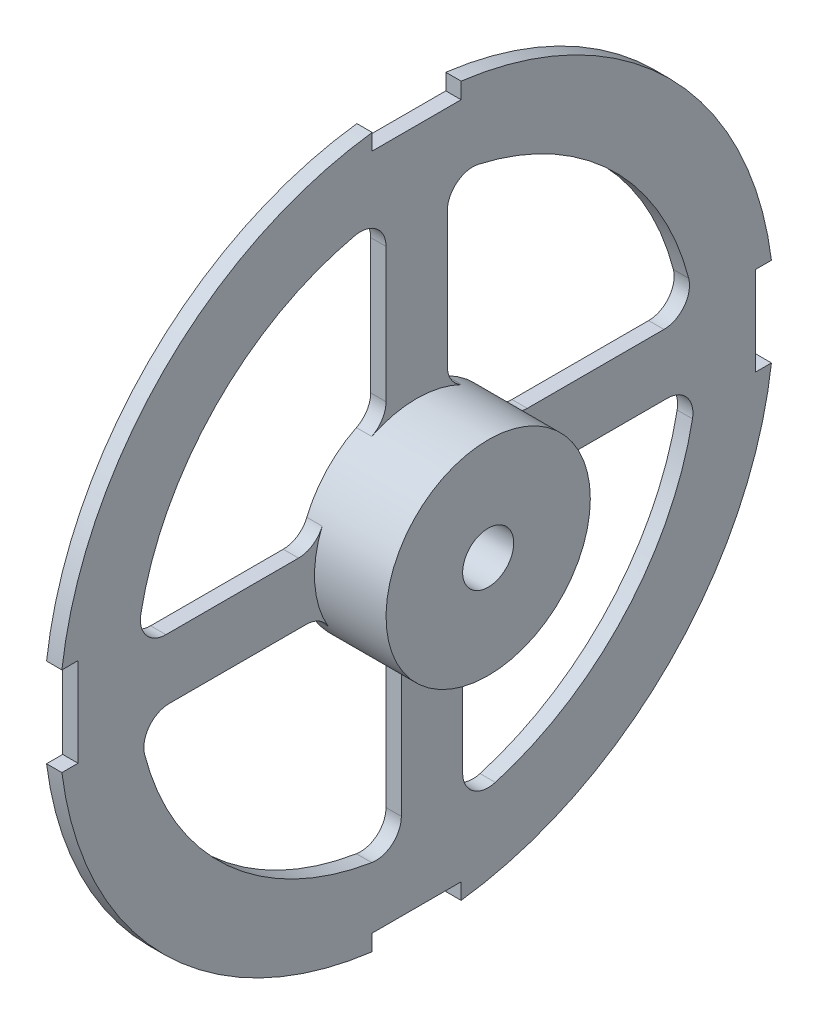
from build123d import *

# Parameters (mm, degrees)
SKETCH1_R           = 2.5
BOSS_EXTRUDE3_DEPTH = 1.5
FILLET1_R           = 2.5
SKETCH3_R           = 10
SKETCH3_R_2         = 2.5
BOSS_EXTRUDE4_DEPTH = 7


with BuildPart() as part:
    # Sketch1 → Boss-Extrude3 (new body)
    with BuildSketch(Plane(origin=(0, 0, 0), x_dir=(0, 0, -1), z_dir=(1, 0, 0))):
        with BuildLine():
            Line((-34.72862652, 4.35), (-33.15, 4.35))
            Line((-33.15, 4.35), (-33.15, -4.35))
            Line((-33.15, -4.35), (-34.72862652, -4.35))
            ThreePointArc((-34.72862652, -4.35), (-24.748737342, -24.748737342), (-4.35, -34.72862652))
            Line((-4.35, -34.72862652), (-4.35, -33.15))
            Line((-4.35, -33.15), (4.35, -33.15))
            Line((4.35, -33.15), (4.35, -34.72862652))
            ThreePointArc((4.35, -34.72862652), (24.748737342, -24.748737342), (34.72862652, -4.35))
            Line((34.72862652, -4.35), (33.15, -4.35))
            Line((33.15, -4.35), (33.15, 4.35))
            Line((33.15, 4.35), (34.72862652, 4.35))
            ThreePointArc((34.72862652, 4.35), (24.748737342, 24.748737342), (4.35, 34.72862652))
            Line((4.35, 34.72862652), (4.35, 33.15))
            Line((4.35, 33.15), (-4.35, 33.15))
            Line((-4.35, 33.15), (-4.35, 34.72862652))
            ThreePointArc((-4.35, 34.72862652), (-24.748737342, 24.748737342), (-34.72862652, 4.35))
        make_face()
        Circle(SKETCH1_R, mode=Mode.SUBTRACT)
        with BuildLine():
            Line((9.270248109, 3.75), (27.243118397, 3.75))
            ThreePointArc((27.243118397, 3.75), (19.17641557, 19.71078603), (3, 27.335873866))
            Line((3, 27.335873866), (3, 9.539392014))
            ThreePointArc((3, 9.539392014), (6.783731432, 7.347175502), (9.270248109, 3.75))
        make_face(mode=Mode.SUBTRACT)
        with BuildLine():
            Line((-3, 9.539392014), (-3, 27.335873866))
            ThreePointArc((-3, 27.335873866), (-19.709993452, 19.177230199), (-27.407799985, 2.25))
            Line((-27.407799985, 2.25), (-9.743587635, 2.25))
            ThreePointArc((-9.743587635, 2.25), (-7.340542585, 6.790908228), (-3, 9.539392014))
        make_face(mode=Mode.SUBTRACT)
        with BuildLine():
            Line((9.743587635, -2.25), (27.407799985, -2.25))
            ThreePointArc((27.407799985, -2.25), (20.230473673, -18.627343744), (4.5, -27.129319933))
            Line((4.5, -27.129319933), (4.5, -8.93028555))
            ThreePointArc((4.5, -8.93028555), (7.866161766, -6.174422974), (9.743587635, -2.25))
        make_face(mode=Mode.SUBTRACT)
        with BuildLine():
            Line((-1.5, -9.886859967), (-1.5, -27.459060435))
            ThreePointArc((-1.5, -27.459060435), (-18.629857769, -20.22815858), (-27.243118397, -3.75))
            Line((-27.243118397, -3.75), (-9.270248109, -3.75))
            ThreePointArc((-9.270248109, -3.75), (-6.197969316, -7.847622338), (-1.5, -9.886859967))
        make_face(mode=Mode.SUBTRACT)
    extrude(amount=BOSS_EXTRUDE3_DEPTH)

    # Fillet1
    fillet1_edges = [part.edges().sort_by_distance(p)[0] for p in [
        (0.75, -9.886859967, 1.5),
        (0.75, -3.75, 9.270248109),
        (0.75, -3.75, 27.243118397),
        (0.75, -27.459060435, 1.5),
        (0.75, 27.335873866, 3),
        (0.75, 2.25, 27.407799985),
        (0.75, 2.25, 9.743587635),
        (0.75, 9.539392014, 3),
        (0.75, 3.75, -27.243118397),
        (0.75, 27.335873866, -3),
        (0.75, 9.539392014, -3),
        (0.75, 3.75, -9.270248109),
        (0.75, -2.25, -9.743587635),
        (0.75, -8.93028555, -4.5),
        (0.75, -27.129319933, -4.5),
        (0.75, -2.25, -27.407799985),
    ]]
    fillet(fillet1_edges, radius=FILLET1_R)

    # Sketch3 → Boss-Extrude4 (add)
    with BuildSketch(Plane(origin=(1.5, 0, 0), x_dir=(0, 0, -1), z_dir=(1, 0, 0))):
        with Locations(Location((0, 0, 0), (0, 0, 157.666317342))):
            Circle(SKETCH3_R)
        Circle(SKETCH3_R_2, mode=Mode.SUBTRACT)
    extrude(amount=BOSS_EXTRUDE4_DEPTH)


solid = part.part
